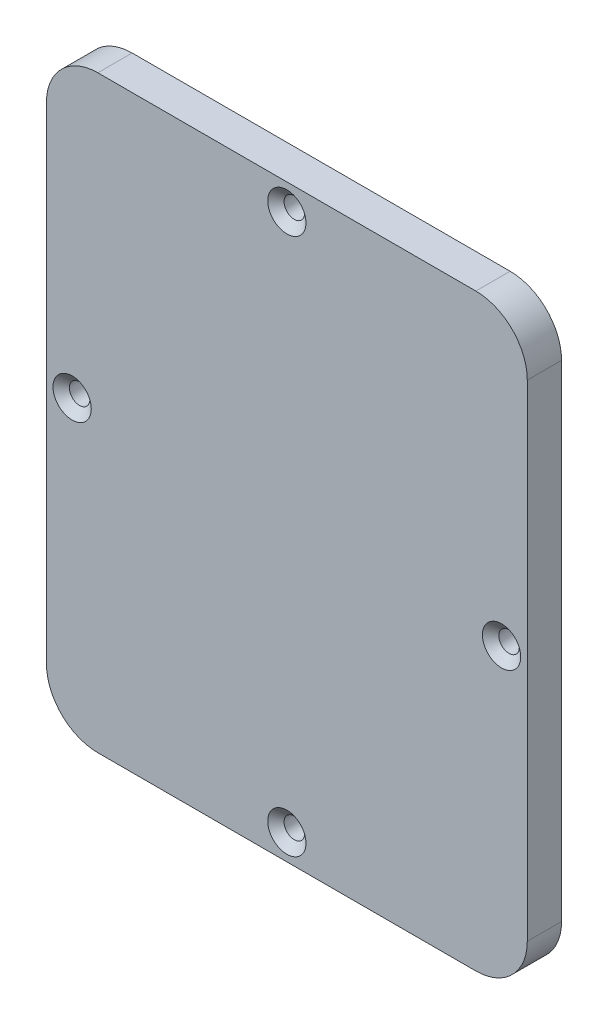
from build123d import *

# Parameters (mm, degrees)
SKETCH1_R                                         = 1.5875
BOSS_EXTRUDE1_DEPTH                               = 6.35
CSK_FOR_6_FLAT_HEAD_MACHINE_SCREW_100_D           = 3.7973
CSK_FOR_6_FLAT_HEAD_MACHINE_SCREW_100_CSINK_D     = 7.0866
CSK_FOR_6_FLAT_HEAD_MACHINE_SCREW_100_CSINK_ANGLE = 100


with BuildPart() as part:
    # Sketch1 → Boss-Extrude1 (new body)
    with BuildSketch(Plane.XY):
        with BuildLine():
            Line((3.175, -6.35), (73.174999954, -6.35))
            ThreePointArc((73.174999954, -6.35), (79.910192045, -3.560192091), (82.699999954, 3.175))
            Line((82.699999954, 3.175), (82.699999954, 93.175000086))
            ThreePointArc((82.699999954, 93.175000086), (79.910192045, 99.910192177), (73.174999954, 102.700000086))
            Line((73.174999954, 102.700000086), (3.175, 102.700000086))
            ThreePointArc((3.175, 102.700000086), (-3.560192091, 99.910192177), (-6.35, 93.175000086))
            Line((-6.35, 93.175000086), (-6.35, 3.175))
            ThreePointArc((-6.35, 3.175), (-3.560192091, -3.560192091), (3.175, -6.35))
        make_face()
        with Locations((38.174999977, -1.5875)):
            Circle(SKETCH1_R, mode=Mode.SUBTRACT)
        with Locations((77.937499954, 48.175000043)):
            Circle(SKETCH1_R, mode=Mode.SUBTRACT)
        with Locations((38.174999977, 97.937500086)):
            Circle(SKETCH1_R, mode=Mode.SUBTRACT)
        with Locations((-1.5875, 48.175000043)):
            Circle(SKETCH1_R, mode=Mode.SUBTRACT)
    extrude(amount=BOSS_EXTRUDE1_DEPTH)

    # CSK for #6 Flat Head Machine Screw (100)1 (through all)
    with Locations(Plane.XY.offset(6.35)):
        with Locations((-1.5875, 48.175000043), (77.937499954, 48.175000043), (38.174999977, -1.5875), (38.174999977, 97.900367712)):
            CounterSinkHole(CSK_FOR_6_FLAT_HEAD_MACHINE_SCREW_100_D / 2, CSK_FOR_6_FLAT_HEAD_MACHINE_SCREW_100_CSINK_D / 2, counter_sink_angle=CSK_FOR_6_FLAT_HEAD_MACHINE_SCREW_100_CSINK_ANGLE)


solid = part.part
